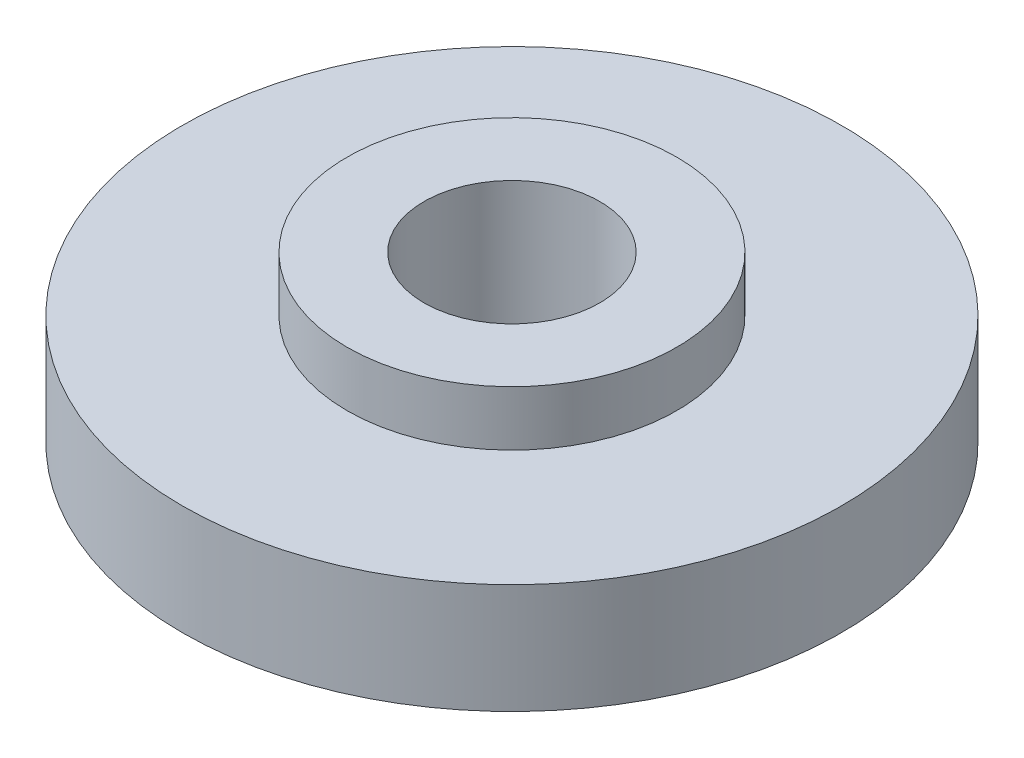
from build123d import *

# Parameters (mm, degrees)
SKETCH1_R           = 6
BOSS_EXTRUDE1_DEPTH = 2
SKETCH2_R           = 3
BOSS_EXTRUDE2_DEPTH = 1
SKETCH3_R           = 1.6
CUT_EXTRUDE1_DEPTH  = 6


with BuildPart() as part:
    # Sketch1 → Boss-Extrude1 (new body)
    with BuildSketch(Plane(origin=(0, 0, 0), x_dir=(1, 0, 0), z_dir=(0, 1, 0))):
        with Locations(Location((0, 0, 0), (0, 0, 270))):
            Circle(SKETCH1_R)
    extrude(amount=BOSS_EXTRUDE1_DEPTH)

    # Sketch2 → Boss-Extrude2 (add)
    with BuildSketch(Plane(origin=(0, 2, 0), x_dir=(1, 0, 0), z_dir=(0, 1, 0))):
        with Locations(Location((0, 0, 0), (0, 0, 270))):
            Circle(SKETCH2_R)
    extrude(amount=BOSS_EXTRUDE2_DEPTH)

    # Sketch3 → Cut-Extrude1 (cut)
    with BuildSketch(Plane(origin=(0, 3, 0), x_dir=(1, 0, 0), z_dir=(0, 1, 0))):
        with Locations(Location((0, 0, 0), (0, 0, 270))):
            Circle(SKETCH3_R)
    extrude(amount=-CUT_EXTRUDE1_DEPTH, mode=Mode.SUBTRACT)


solid = part.part
